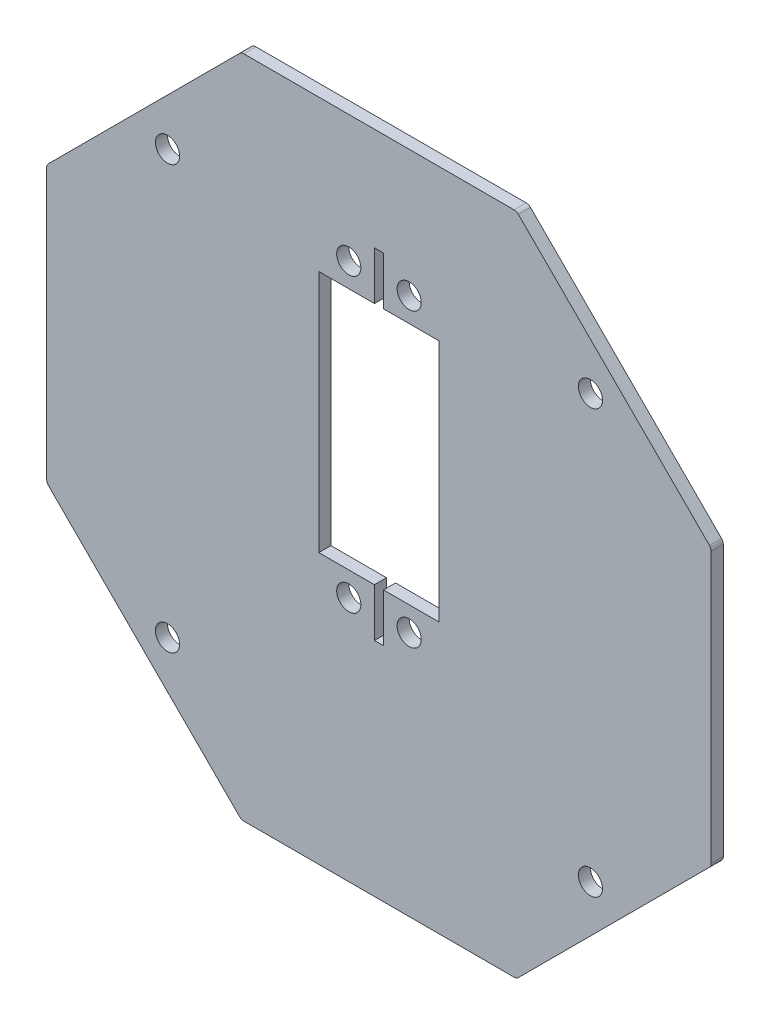
from build123d import *

# Parameters (mm, degrees)
MODEL_R             = 2
EXTRUDE_1_DEPTH     = 2
SKETCH_3_W          = 0.1
SKETCH_3_H          = 8
CUT_EXTRUDE_1_DEPTH = 2
SKETCH_6_W          = 0.1
SKETCH_6_H          = 8
CUT_EXTRUDE_2_DEPTH = 2


with BuildPart() as part:
    # Model → 凸台-拉伸1 (new body)
    with BuildSketch(Plane.XY):
        with BuildLine():
            Line((2557.684762722, 2001.48951402), (2512.949697986, 2001.48951402))
            ThreePointArc((2512.949697986, 2001.48951402), (2512.567014553, 2001.413393553), (2512.242591205, 2001.196620802))
            Line((2512.242591205, 2001.196620802), (2480.610123573, 1969.56415317))
            ThreePointArc((2480.610123573, 1969.56415317), (2480.393350821, 1969.239729821), (2480.317230354, 1968.857046389))
            Line((2480.317230354, 1968.857046389), (2480.317230354, 1924.121981652))
            ThreePointArc((2480.317230354, 1924.121981652), (2480.393350821, 1923.73929822), (2480.610123573, 1923.414874871))
            Line((2480.610123573, 1923.414874871), (2512.242591205, 1891.782407239))
            ThreePointArc((2512.242591205, 1891.782407239), (2512.567014553, 1891.565634488), (2512.949697986, 1891.48951402))
            Line((2512.949697986, 1891.48951402), (2557.684762722, 1891.48951402))
            ThreePointArc((2557.684762722, 1891.48951402), (2558.067446154, 1891.565634488), (2558.391869503, 1891.782407239))
            Line((2558.391869503, 1891.782407239), (2590.024337135, 1923.414874871))
            ThreePointArc((2590.024337135, 1923.414874871), (2590.241109886, 1923.73929822), (2590.317230354, 1924.121981652))
            Line((2590.317230354, 1924.121981652), (2590.317230354, 1968.857046389))
            ThreePointArc((2590.317230354, 1968.857046389), (2590.241109886, 1969.239729821), (2590.024337135, 1969.56415317))
            Line((2590.024337135, 1969.56415317), (2558.391869503, 2001.196620802))
            ThreePointArc((2558.391869503, 2001.196620802), (2558.067446154, 2001.413393553), (2557.684762722, 2001.48951402))
        make_face()
        with Locations((2500.315444685, 1911.487728352)):
            Circle(MODEL_R, mode=Mode.SUBTRACT)
        with Locations((2570.319016023, 1981.491299689)):
            Circle(MODEL_R, mode=Mode.SUBTRACT)
        with Locations((2530.317230354, 1980.496859135)):
            Circle(MODEL_R, mode=Mode.SUBTRACT)
        with Locations((2540.317230354, 1932.196859135)):
            Circle(MODEL_R, mode=Mode.SUBTRACT)
        with Locations((2540.317230354, 1980.496859135)):
            Circle(MODEL_R, mode=Mode.SUBTRACT)
        with Locations((2500.315444685, 1981.491299689)):
            Circle(MODEL_R, mode=Mode.SUBTRACT)
        with Locations((2570.319016023, 1911.487728352)):
            Circle(MODEL_R, mode=Mode.SUBTRACT)
        with Locations((2530.317230354, 1932.196859135)):
            Circle(MODEL_R, mode=Mode.SUBTRACT)
        Polygon((2535.967230354, 1976.491859135), (2535.967230354, 1984.491859135), (2534.667230354, 1984.491859135), (2534.667230354, 1976.491859135), (2525.357779796, 1976.491859135), (2525.357779796, 1936.191859135), (2534.667230354, 1936.191859135), (2534.667230354, 1928.191859135), (2535.967230354, 1928.191859135), (2535.967230354, 1936.191859135), (2545.276680912, 1936.191859135), (2545.276680912, 1976.491859135), align=None, mode=Mode.SUBTRACT)
    extrude(amount=EXTRUDE_1_DEPTH)

    # 草图3 → 切除-拉伸1 (cut)
    with BuildSketch(Plane.XY.offset(2)):
        with Locations((2536.017230354, 1932.191859135)):
            Rectangle(SKETCH_3_W, SKETCH_3_H)
        with Locations((2534.617230354, 1932.191859135)):
            Rectangle(SKETCH_3_W, SKETCH_3_H)
    extrude(amount=-CUT_EXTRUDE_1_DEPTH, mode=Mode.SUBTRACT)

    # 草图6 → 切除-拉伸2 (cut)
    with BuildSketch(Plane.XY.offset(2)):
        with Locations((2536.017230354, 1980.491859135)):
            Rectangle(SKETCH_6_W, SKETCH_6_H)
        with Locations((2534.617230354, 1980.491859135)):
            Rectangle(SKETCH_6_W, SKETCH_6_H)
    extrude(amount=-CUT_EXTRUDE_2_DEPTH, mode=Mode.SUBTRACT)


solid = part.part
